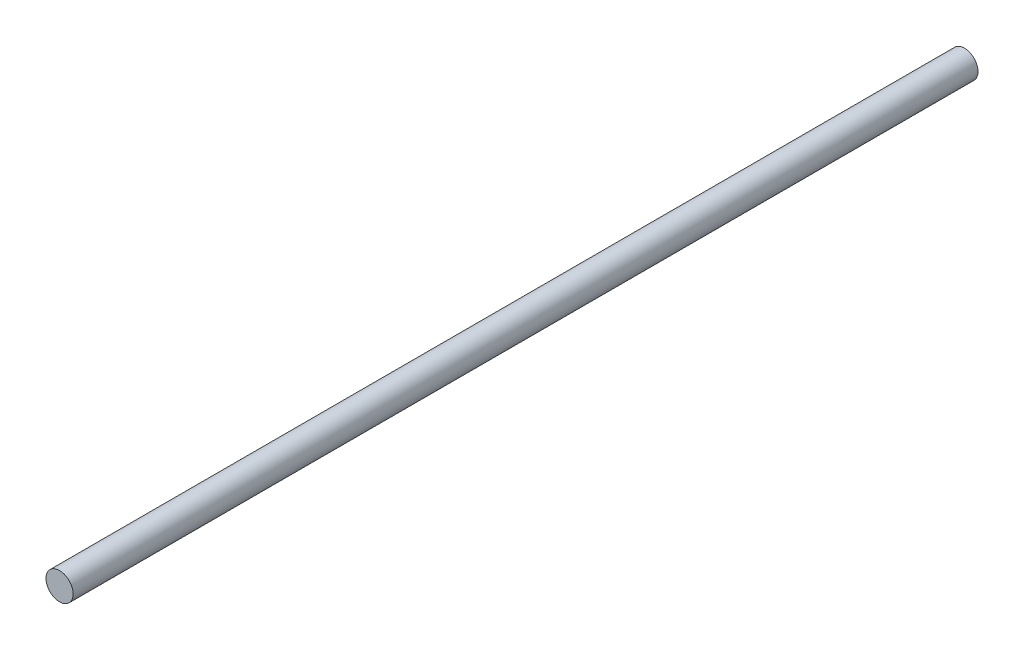
from build123d import *

# Parameters (mm, degrees)
SKETCH_1_R      = 6
EXTRUDE_1_DEPTH = 400


with BuildPart() as part:
    # 草图1 → 凸台-拉伸1 (new body)
    with BuildSketch(Plane.XY):
        Circle(SKETCH_1_R)
    extrude(amount=EXTRUDE_1_DEPTH)


solid = part.part
